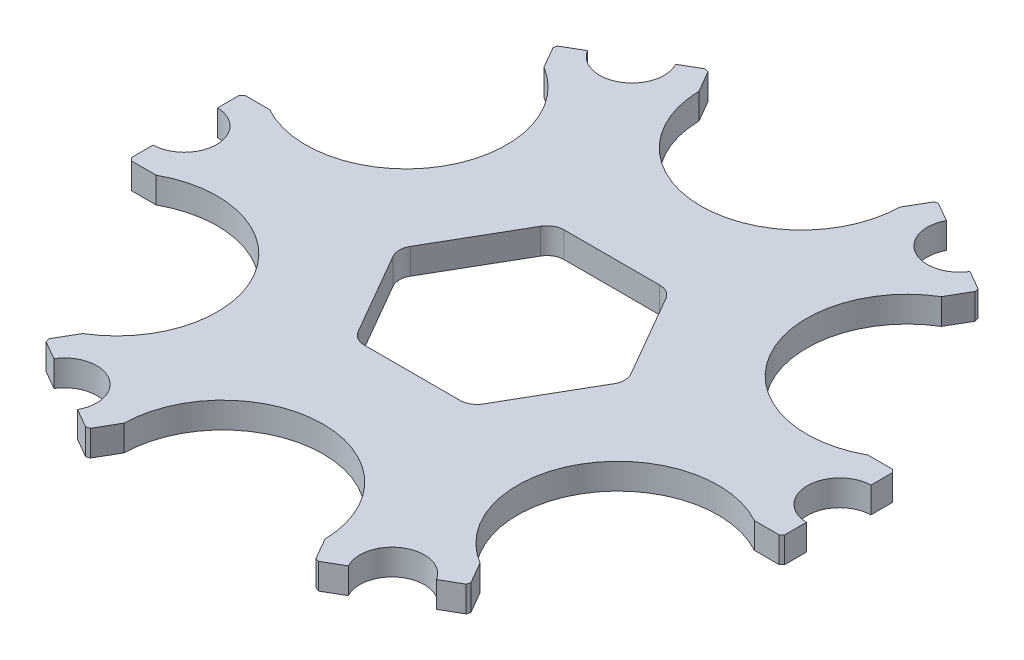
from build123d import *

# Parameters (mm, degrees)
BOSS_EXTRUDE1_DEPTH = 4.7625
CHAMFER1_SIZE       = 0.508
FILLET1_R           = 3.175


with BuildPart() as part:
    # Sketch1 → Boss-Extrude1 (new body)
    with BuildSketch(Plane(origin=(0, 0, 0), x_dir=(1, 0, 0), z_dir=(0, 1, 0))):
        with BuildLine():
            Line((-55.1561, 10.4648), (-60.2361, 10.4648))
            Line((-60.2361, 10.4648), (-60.2361, 5.950469261))
            ThreePointArc((-60.2361, 5.950469261), (-54.460775, 0), (-60.2361, -5.950469261))
            Line((-60.2361, -5.950469261), (-60.2361, -10.4648))
            Line((-60.2361, -10.4648), (-55.1561, -10.4648))
            ThreePointArc((-55.1561, -10.4648), (-30.156383683, -17.410796237), (-36.640832646, -42.534183774))
            Line((-36.640832646, -42.534183774), (-39.180832646, -46.933592825))
            Line((-39.180832646, -46.933592825), (-35.271307544, -49.190758194))
            ThreePointArc((-35.271307544, -49.190758194), (-27.2303875, -47.16441466), (-24.964792456, -55.141227455))
            Line((-24.964792456, -55.141227455), (-21.055267354, -57.398392825))
            Line((-21.055267354, -57.398392825), (-18.515267354, -52.998983774))
            ThreePointArc((-18.515267354, -52.998983774), (0, -34.821592475), (18.515267354, -52.998983774))
            Line((18.515267354, -52.998983774), (21.055267354, -57.398392825))
            Line((21.055267354, -57.398392825), (24.964792456, -55.141227455))
            ThreePointArc((24.964792456, -55.141227455), (27.2303875, -47.16441466), (35.271307544, -49.190758194))
            Line((35.271307544, -49.190758194), (39.180832646, -46.933592825))
            Line((39.180832646, -46.933592825), (36.640832646, -42.534183774))
            ThreePointArc((36.640832646, -42.534183774), (30.156383683, -17.410796237), (55.1561, -10.4648))
            Line((55.1561, -10.4648), (60.2361, -10.4648))
            Line((60.2361, -10.4648), (60.2361, -5.950469261))
            ThreePointArc((60.2361, -5.950469261), (54.460775, 0), (60.2361, 5.950469261))
            Line((60.2361, 5.950469261), (60.2361, 10.4648))
            Line((60.2361, 10.4648), (55.1561, 10.4648))
            ThreePointArc((55.1561, 10.4648), (30.156383683, 17.410796237), (36.640832646, 42.534183774))
            Line((36.640832646, 42.534183774), (39.180832646, 46.933592825))
            Line((39.180832646, 46.933592825), (35.271307544, 49.190758194))
            ThreePointArc((35.271307544, 49.190758194), (27.2303875, 47.16441466), (24.964792456, 55.141227455))
            Line((24.964792456, 55.141227455), (21.055267354, 57.398392825))
            Line((21.055267354, 57.398392825), (18.515267354, 52.998983774))
            ThreePointArc((18.515267354, 52.998983774), (0, 34.821592475), (-18.515267354, 52.998983774))
            Line((-18.515267354, 52.998983774), (-21.055267354, 57.398392825))
            Line((-21.055267354, 57.398392825), (-24.964792456, 55.141227455))
            ThreePointArc((-24.964792456, 55.141227455), (-27.2303875, 47.16441466), (-35.271307544, 49.190758194))
            Line((-35.271307544, 49.190758194), (-39.180832646, 46.933592825))
            Line((-39.180832646, 46.933592825), (-36.640832646, 42.534183774))
            ThreePointArc((-36.640832646, 42.534183774), (-30.156383683, 17.410796237), (-55.1561, 10.4648))
        make_face()
        Polygon((-10.631905207, 18.415), (10.631905207, 18.415), (21.263810414, 0), (10.631905207, -18.415), (-10.631905207, -18.415), (-21.263810414, 0), align=None, mode=Mode.SUBTRACT)
    extrude(amount=BOSS_EXTRUDE1_DEPTH)

    # Chamfer1
    chamfer1_edges = [part.edges().sort_by_distance(p)[0] for p in [
        (-60.2361, 2.38125, 10.4648),
        (-39.180832646, 2.38125, 46.933592825),
        (-21.055267354, 2.38125, 57.398392825),
        (21.055267354, 2.38125, 57.398392825),
        (39.180832646, 2.38125, 46.933592825),
        (60.2361, 2.38125, 10.4648),
        (60.2361, 2.38125, -10.4648),
        (39.180832646, 2.38125, -46.933592825),
        (21.055267354, 2.38125, -57.398392825),
        (-21.055267354, 2.38125, -57.398392825),
        (-39.180832646, 2.38125, -46.933592825),
        (-60.2361, 2.38125, -10.4648),
    ]]
    chamfer(chamfer1_edges, length=CHAMFER1_SIZE)

    # Fillet1
    fillet1_edges = [part.edges().sort_by_distance(p)[0] for p in [
        (-21.263810414, 2.38125, 0),
        (-10.631905207, 2.38125, 18.415),
        (10.631905207, 2.38125, 18.415),
        (21.263810414, 2.38125, 0),
        (10.631905207, 2.38125, -18.415),
        (-10.631905207, 2.38125, -18.415),
    ]]
    fillet(fillet1_edges, radius=FILLET1_R)


solid = part.part
